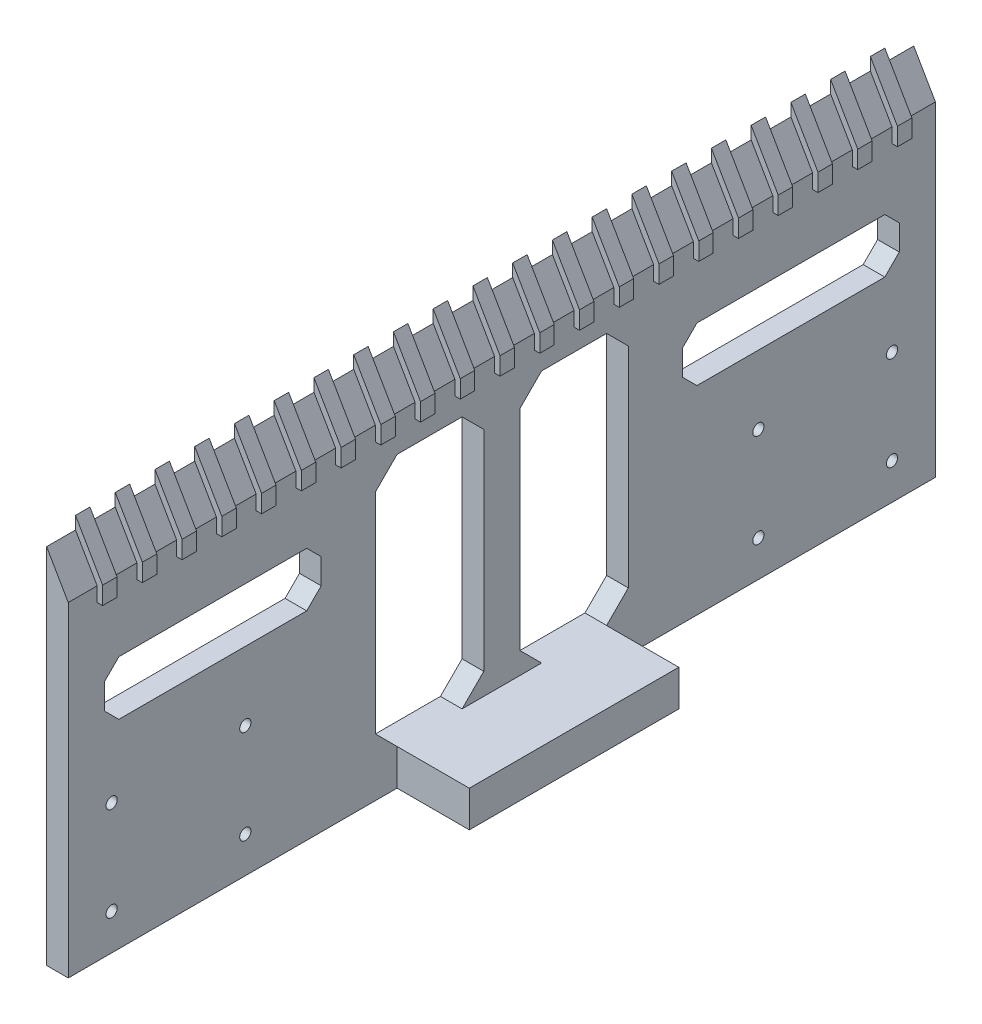
from build123d import *

# Parameters (mm, degrees)
SKETCH_1_W                 = 240
SKETCH_1_H                 = 90
EXTRUDE_1_DEPTH            = 6
SKETCH_2_R                 = 1.55
CUT_EXTRUDE_1_DEPTH        = 257.390327431
SKETCH_3_W                 = 60
SKETCH_3_H                 = 15
CUT_EXTRUDE_2_DEPTH        = 257.390327431
SKETCH_4_W                 = 30
SKETCH_4_H                 = 70
CUT_EXTRUDE_3_DEPTH        = 257.390327431
SKETCH_5_R                 = 3
CUT_EXTRUDE_4_DEPTH        = 3
EXTRUDE_2_DEPTH            = 240
CHAMFER_1_SIZE             = 4
CHAMFER_2_SIZE             = 6
EXTRUDE_3_DEPTH            = 2
PATTERN_LINEAR_1_COUNT     = 11
PATTERN_LINEAR_1_PITCH     = 11
PATTERN_LINEAR_1_COL_COUNT = 11
PATTERN_LINEAR_1_COL_PITCH = 11
SKETCH_9_W                 = 57.973194975
SKETCH_9_H                 = 10
EXTRUDE_4_DEPTH            = 20


with BuildPart() as part:
    # 草图1 → 凸台-拉伸1 (new body)
    with BuildSketch(Plane(origin=(0, 0, 0), x_dir=(0, 0, -1), z_dir=(1, 0, 0))):
        with Locations((120, -45)):
            Rectangle(SKETCH_1_W, SKETCH_1_H)
    extrude(amount=EXTRUDE_1_DEPTH)

    # 草图2 → 切除-拉伸1 (cut, through all)
    with BuildSketch(Plane(origin=(6, 0, 0), x_dir=(0, 0, -1), z_dir=(1, 0, 0))):
        with Locations((12, -54)):
            Circle(SKETCH_2_R)
        with Locations((49, -80)):
            Circle(SKETCH_2_R)
        with Locations((49, -54)):
            Circle(SKETCH_2_R)
        with Locations((12, -80)):
            Circle(SKETCH_2_R)
        with Locations(Location((228, -80, 0), (0, 0, 180))):
            Circle(SKETCH_2_R)
        with Locations(Location((191, -54, 0), (0, 0, 180))):
            Circle(SKETCH_2_R)
        with Locations(Location((191, -80, 0), (0, 0, 180))):
            Circle(SKETCH_2_R)
        with Locations(Location((228, -54, 0), (0, 0, 180))):
            Circle(SKETCH_2_R)
    extrude(amount=-CUT_EXTRUDE_1_DEPTH, mode=Mode.SUBTRACT)

    # 草图3 → 切除-拉伸2 (cut, through all)
    with BuildSketch(Plane(origin=(6, 0, 0), x_dir=(0, 0, -1), z_dir=(1, 0, 0))):
        with Locations((40, -27.5)):
            Rectangle(SKETCH_3_W, SKETCH_3_H)
        with Locations((200, -27.5)):
            Rectangle(SKETCH_3_W, SKETCH_3_H)
    extrude(amount=-CUT_EXTRUDE_2_DEPTH, mode=Mode.SUBTRACT)

    # 草图4 → 切除-拉伸3 (cut, through all)
    with BuildSketch(Plane(origin=(6, 0, 0), x_dir=(0, 0, -1), z_dir=(1, 0, 0))):
        with Locations((100, -45)):
            Rectangle(SKETCH_4_W, SKETCH_4_H)
        with Locations((140, -45)):
            Rectangle(SKETCH_4_W, SKETCH_4_H)
    extrude(amount=-CUT_EXTRUDE_3_DEPTH, mode=Mode.SUBTRACT)

    # 草图5 → 切除-拉伸4 (cut)
    with BuildSketch(Plane.ZY):
        with Locations((-191, -80)):
            Circle(SKETCH_5_R)
        with Locations((-228, -80)):
            Circle(SKETCH_5_R)
        with Locations((-191, -54)):
            Circle(SKETCH_5_R)
        with Locations((-228, -54)):
            Circle(SKETCH_5_R)
        with Locations((-45, -80)):
            Circle(SKETCH_5_R)
        with Locations((-12, -80)):
            Circle(SKETCH_5_R)
        with Locations((-12, -54)):
            Circle(SKETCH_5_R)
        with Locations((-49, -54)):
            Circle(SKETCH_5_R)
    extrude(amount=-CUT_EXTRUDE_4_DEPTH, mode=Mode.SUBTRACT)

    # 草图6 → 凸台-拉伸2 (add)
    with BuildSketch(Plane.XY):
        Polygon((6, 0), (0, 0), (0, 10.392304845), align=None)
    extrude(amount=-EXTRUDE_2_DEPTH)

    # 倒角1
    chamfer_1_edges = [part.edges().sort_by_distance(p)[0] for p in [
        (3, -35, -10),
        (3, -20, -10),
        (3, -20, -70),
        (3, -35, -70),
        (3, -20, -170),
        (3, -20, -230),
        (3, -35, -230),
        (3, -35, -170),
    ]]
    chamfer(chamfer_1_edges, length=CHAMFER_1_SIZE)

    # 倒角2
    chamfer_2_edges = [part.edges().sort_by_distance(p)[0] for p in [
        (3, -10, -115),
        (3, -80, -115),
        (3, -80, -85),
        (3, -10, -85),
        (3, -10, -125),
        (3, -10, -155),
        (3, -80, -155),
        (3, -80, -125),
    ]]
    chamfer(chamfer_2_edges, length=CHAMFER_2_SIZE)

    # 草图8 → 凸台-拉伸3 (add, symmetric)
    with BuildSketch(Plane.XY.offset(-120)):
        Polygon((0, 10.392304845), (0, 13.892304845), (7.5, 0.901923789), (7.5, -4), (6, -4), (6, 0), align=None)
    extrude_3 = extrude(amount=EXTRUDE_3_DEPTH, both=True)

    # 阵列(线性)1: 凸台-拉伸3 ×11
    with Locations(*[(0, 0, i * PATTERN_LINEAR_1_PITCH) for i in range(1, PATTERN_LINEAR_1_COUNT)]):
        add(extrude_3)

    # 阵列(线性)1 col: 凸台-拉伸3 ×11
    with Locations(*[(0, 0, -i * PATTERN_LINEAR_1_COL_PITCH) for i in range(1, PATTERN_LINEAR_1_COL_COUNT)]):
        add(extrude_3)

    # 草图9 → 凸台-拉伸4 (add)
    with BuildSketch(Plane(origin=(6, 0, 0), x_dir=(0, 0, -1), z_dir=(1, 0, 0))):
        with Locations((119.986597488, -85)):
            Rectangle(SKETCH_9_W, SKETCH_9_H)
    extrude(amount=EXTRUDE_4_DEPTH)


solid = part.part
